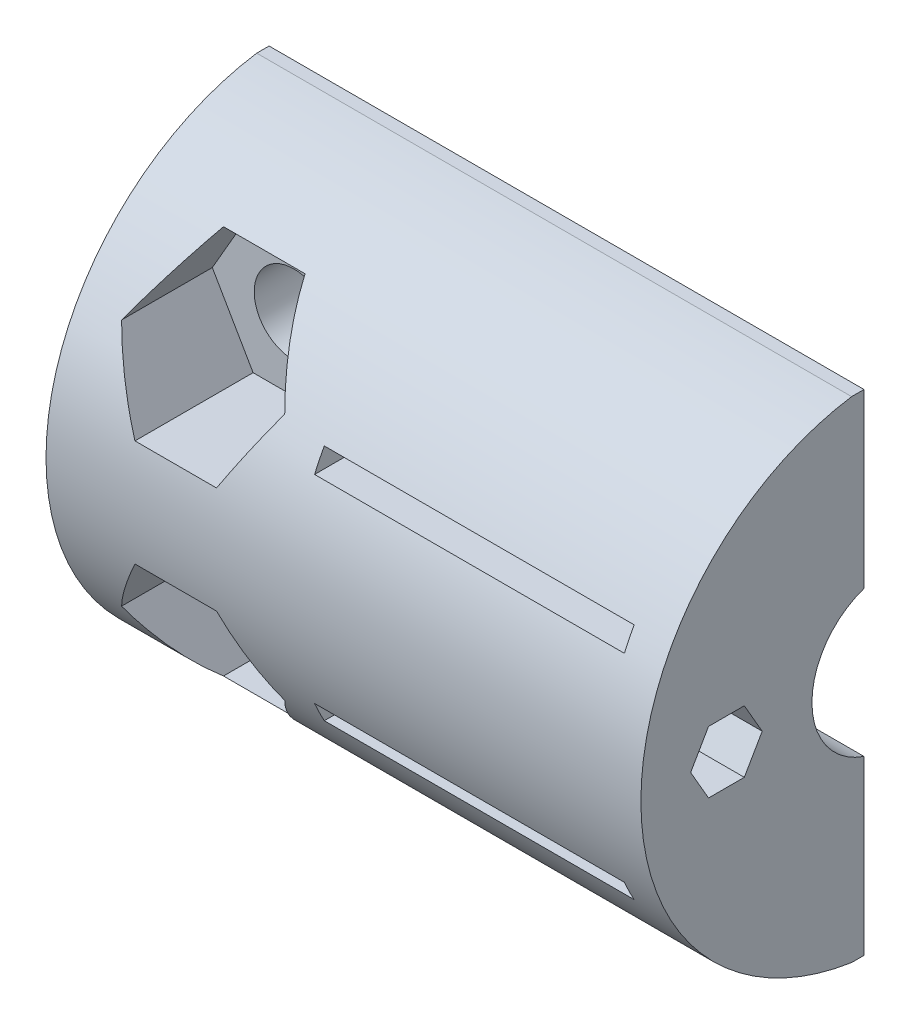
from build123d import *

# Parameters (mm, degrees)
AUFSATZ_LINEAR_AUSTRAGEN1_DEPTH      = 14
AUFSATZ_LINEAR_AUSTRAGEN1_DEPTH_BACK = 10
SKIZZE2_W                            = 12.5
SKIZZE2_H                            = 0.8
SCHNITT_LINEAR_AUSTRAGEN1_DEPTH      = 20.843134833
SCHNITT_LINEAR_START                 = 5
SCHNITT_LINEAR_AUSTRAGEN2_DEPTH      = 15.843134833
SKIZZE4_R                            = 1.6
SCHNITT_LINEAR_AUSTRAGEN3_DEPTH      = 20.843134833
SCHNITT_LINEAR_START_2               = 14
SCHNITT_LINEAR_AUSTRAGEN4_DEPTH      = 10


with BuildPart() as part:
    # Skizze1 → Aufsatz-Linear austragen1 (new, two sides: drawn at the far end of the back side and taken through both)
    with BuildSketch(Plane(origin=(0, 0, 0), x_dir=(0, 0, -1), z_dir=(1, 0, 0)).offset(-AUFSATZ_LINEAR_AUSTRAGEN1_DEPTH_BACK)):
        with BuildLine():
            Line((-1.5, 9.886859967), (-1, 9.886859967))
            Line((-1, 9.886859967), (-1, 2.93428015))
            ThreePointArc((-1, 2.93428015), (-3.1, 0), (-1, -2.93428015))
            Line((-1, -2.93428015), (-1, -9.886859967))
            Line((-1, -9.886859967), (-1.5, -9.886859967))
            ThreePointArc((-1.5, -9.886859967), (-10, 0), (-1.5, 9.886859967))
        make_face()
    extrude(amount=AUFSATZ_LINEAR_AUSTRAGEN1_DEPTH + AUFSATZ_LINEAR_AUSTRAGEN1_DEPTH_BACK)

    # Skizze2 → Schnitt-Linear austragen1 (cut, through all)
    with BuildSketch(Plane.XY):
        with Locations((6.25, 4.4)):
            Rectangle(SKIZZE2_W, SKIZZE2_H)
    schnitt_linear_austragen1 = extrude(amount=SCHNITT_LINEAR_AUSTRAGEN1_DEPTH, mode=Mode.SUBTRACT)

    # Skizze3 → Schnitt-Linear austragen2 (cut, through all)
    with BuildSketch(Plane.XY.offset(SCHNITT_LINEAR_START)):
        Polygon((-3.354551733, 2.15), (-1.709103466, 5), (-3.354551733, 7.85), (-6.645448267, 7.85), (-8.290896534, 5), (-6.645448267, 2.15), align=None)
    schnitt_linear_austragen2 = extrude(amount=SCHNITT_LINEAR_AUSTRAGEN2_DEPTH, mode=Mode.SUBTRACT)

    # Skizze4 → Schnitt-Linear austragen3 (cut, through all)
    with BuildSketch(Plane.XY):
        with Locations(Location((-5, 5, 0), (0, 0, 90))):
            Circle(SKIZZE4_R)
    schnitt_linear_austragen3 = extrude(amount=SCHNITT_LINEAR_AUSTRAGEN3_DEPTH, mode=Mode.SUBTRACT)

    # Spiegeln1: Schnitt-Linear austragen1, Schnitt-Linear austragen2, Schnitt-Linear austragen3 across plane
    add(schnitt_linear_austragen1.mirror(Plane.ZX), mode=Mode.SUBTRACT)
    add(schnitt_linear_austragen2.mirror(Plane.ZX), mode=Mode.SUBTRACT)
    add(schnitt_linear_austragen3.mirror(Plane.ZX), mode=Mode.SUBTRACT)

    # Skizze6 → Schnitt-Linear austragen4 (cut)
    with BuildSketch(Plane(origin=(0, 0, 0), x_dir=(0, 0, -1), z_dir=(1, 0, 0)).offset(SCHNITT_LINEAR_START_2)):
        Polygon((-5.828312164, 1.25), (-7.271687836, 1.25), (-7.993375673, 0), (-7.271687836, -1.25), (-5.828312164, -1.25), (-5.106624327, 0), align=None)
    extrude(amount=-SCHNITT_LINEAR_AUSTRAGEN4_DEPTH, mode=Mode.SUBTRACT)


solid = part.part
